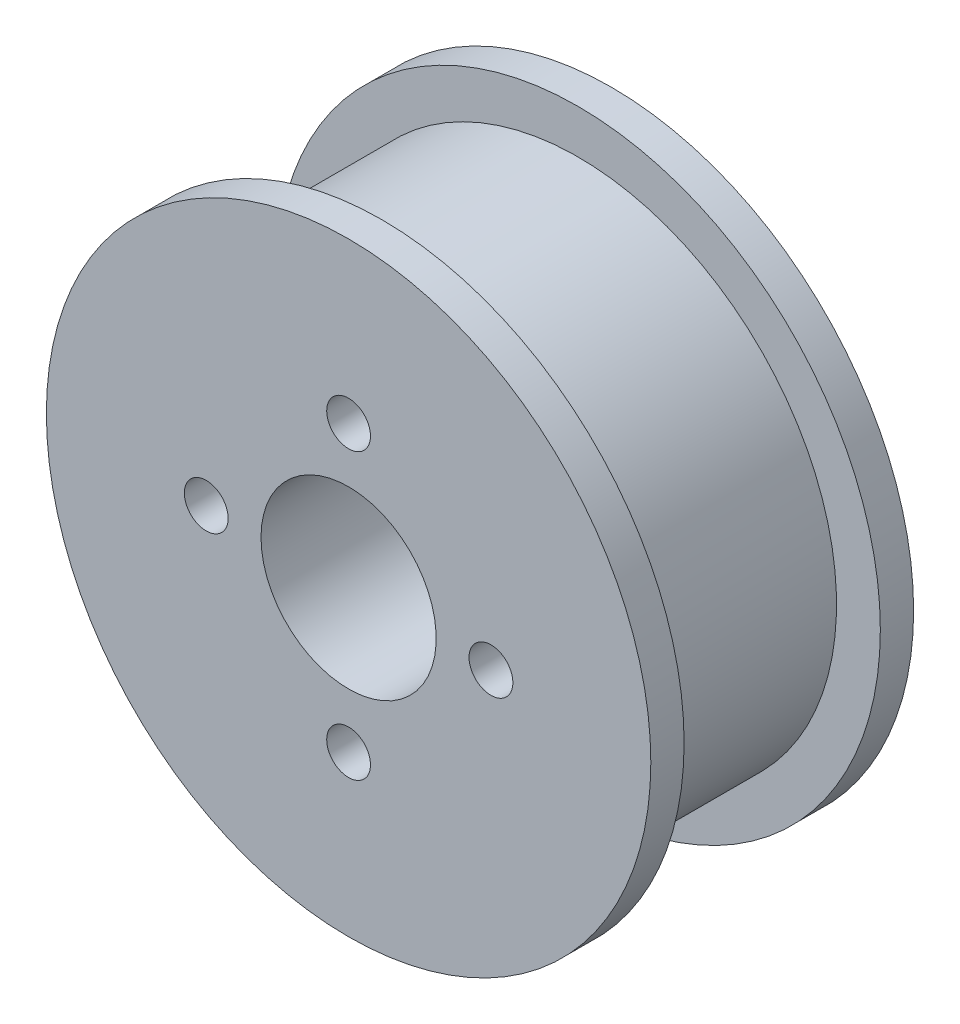
from build123d import *

# Parameters (mm, degrees)
SKETCH1_R           = 17.25
BOSS_EXTRUDE1_DEPTH = 1.9
SKETCH2_R           = 14.75
BOSS_EXTRUDE2_DEPTH = 11.2
BOSS_EXTRUDE3_START = 1.9
SKETCH3_R           = 17.25
BOSS_EXTRUDE3_DEPTH = 1.9
SKETCH4_R           = 5
CUT_EXTRUDE1_DEPTH  = 29.637824638
SKETCH5_R           = 1.25
CUT_EXTRUDE2_DEPTH  = 29.637824638


with BuildPart() as part:
    # Sketch1 → Boss-Extrude1 (new body)
    with BuildSketch(Plane.XY):
        with Locations(Location((0, 0, 0), (0, 0, 180))):
            Circle(SKETCH1_R)
    extrude(amount=BOSS_EXTRUDE1_DEPTH)

    # Sketch2 → Boss-Extrude2 (add)
    with BuildSketch(Plane(origin=(0, 0, 0), x_dir=(-1, 0, 0), z_dir=(0, 0, -1))):
        Circle(SKETCH2_R)
    extrude(amount=BOSS_EXTRUDE2_DEPTH)

    # Sketch3 → Boss-Extrude3 (add)
    with BuildSketch(Plane(origin=(0, 0, -11.2), x_dir=(-1, 0, 0), z_dir=(0, 0, -1)).offset(BOSS_EXTRUDE3_START)):
        Circle(SKETCH3_R)
    extrude(amount=-BOSS_EXTRUDE3_DEPTH)

    # Sketch4 → Cut-Extrude1 (cut, through all)
    with BuildSketch(Plane(origin=(0, 0, -13.1), x_dir=(-1, 0, 0), z_dir=(0, 0, -1))):
        Circle(SKETCH4_R)
    extrude(amount=-CUT_EXTRUDE1_DEPTH, mode=Mode.SUBTRACT)

    # Sketch5 → Cut-Extrude2 (cut, through all)
    with BuildSketch(Plane(origin=(0, 0, -13.1), x_dir=(-1, 0, 0), z_dir=(0, 0, -1))):
        with Locations((0, 8.125)):
            Circle(SKETCH5_R)
        with Locations((8.125, 0)):
            Circle(SKETCH5_R)
        with Locations((0, -8.125)):
            Circle(SKETCH5_R)
        with Locations((-8.125, 0)):
            Circle(SKETCH5_R)
    extrude(amount=-CUT_EXTRUDE2_DEPTH, mode=Mode.SUBTRACT)


solid = part.part
